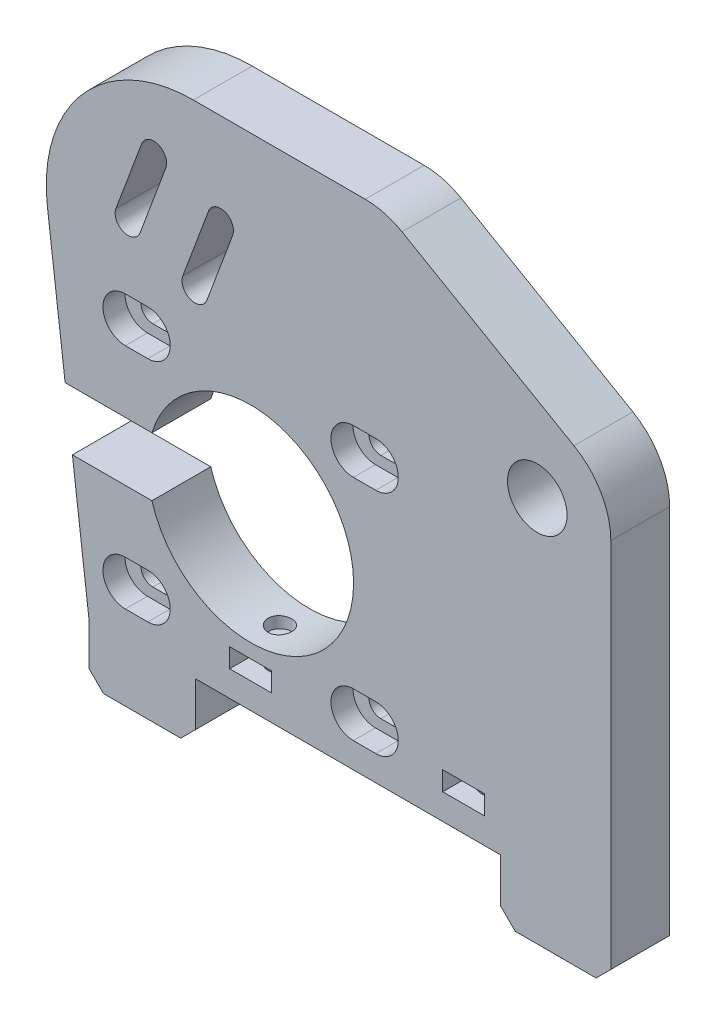
from build123d import *

# Parameters (mm, degrees)
SKETCH_3_R          = 4.05
SKETCH_3_W          = 6.1
SKETCH_3_H          = 3
EXTRUDE_1_DEPTH     = 8
CUT_EXTRUDE_2_DEPTH = 3
SKETCH_6_R          = 1.6
CUT_EXTRUDE_3_DEPTH = 15
SKETCH_7_R          = 4.05
CUT_EXTRUDE_4_DEPTH = 68.662198854
CHAMFER_1_SIZE      = 2
EXTRUDE_2_DEPTH     = 8


with BuildPart() as part:
    # 草图3 → 凸台-拉伸1 (new body)
    with BuildSketch(Plane.XY):
        with BuildLine():
            Line((43.971143614, 31.160253781), (20.588455044, 44.660256921))
            ThreePointArc((20.588455044, 44.660256921), (18.176645298, 45.659261336), (15.5884546, 46.000003139))
            Line((15.5884546, 46.000003139), (-7.779942733, 46.000003139))
            ThreePointArc((-7.779942733, 46.000003139), (-22.764282879, 39.246495142), (-27.628936924, 23.546958177))
            Line((-27.628936924, 23.546958177), (-25.213219189, 4))
            Line((-25.213219189, 4), (-13.416407865, 4))
            ThreePointArc((-13.416407865, 4), (14, 0), (-13.416407865, -4))
            Line((-13.416407865, -4), (-24.224536362, -4))
            Line((-24.224536362, -4), (-22, -22))
            Line((-22, -22), (-22, -30))
            Line((-22, -30), (-7.5, -30))
            Line((-7.5, -30), (-7.5, -22))
            Line((-7.5, -22), (33.97114317, -22))
            Line((33.97114317, -22), (33.97114317, -30))
            Line((33.97114317, -30), (48.97114317, -30))
            Line((48.97114317, -30), (48.97114317, 22.5))
            ThreePointArc((48.97114317, 22.5), (47.631397336, 27.499999778), (43.971143614, 31.160253781))
        make_face()
        with Locations((38.97114317, 22.5)):
            Circle(SKETCH_3_R, mode=Mode.SUBTRACT)
        with Locations((0, -17)):
            Rectangle(SKETCH_3_W, SKETCH_3_H, mode=Mode.SUBTRACT)
        with BuildLine():
            Line((-16.3, 17.1), (-14.7, 17.1))
            ThreePointArc((-14.7, 17.1), (-13.1, 15.5), (-14.7, 13.9))
            Line((-14.7, 13.9), (-16.3, 13.9))
            ThreePointArc((-16.3, 13.9), (-17.9, 15.5), (-16.3, 17.1))
        make_face(mode=Mode.SUBTRACT)
        with BuildLine():
            Line((14.7, 17.1), (16.3, 17.1))
            ThreePointArc((16.3, 17.1), (17.9, 15.5), (16.3, 13.9))
            Line((16.3, 13.9), (14.7, 13.9))
            ThreePointArc((14.7, 13.9), (13.1, 15.5), (14.7, 17.1))
        make_face(mode=Mode.SUBTRACT)
        with BuildLine():
            Line((14.7, -13.9), (16.3, -13.9))
            ThreePointArc((16.3, -13.9), (17.9, -15.5), (16.3, -17.1))
            Line((16.3, -17.1), (14.7, -17.1))
            ThreePointArc((14.7, -17.1), (13.1, -15.5), (14.7, -13.9))
        make_face(mode=Mode.SUBTRACT)
        with BuildLine():
            Line((-16.3, -13.9), (-14.7, -13.9))
            ThreePointArc((-14.7, -13.9), (-13.1, -15.5), (-14.7, -17.1))
            Line((-14.7, -17.1), (-16.3, -17.1))
            ThreePointArc((-16.3, -17.1), (-17.9, -15.5), (-16.3, -13.9))
        make_face(mode=Mode.SUBTRACT)
        with Locations((28.97114317, -17)):
            Rectangle(SKETCH_3_W, SKETCH_3_H, mode=Mode.SUBTRACT)
    extrude(amount=EXTRUDE_1_DEPTH)

    # 草图5 → 切除-拉伸2 (cut)
    with BuildSketch(Plane.XY.offset(8)):
        with BuildLine():
            Line((-17.025, 18.55), (-13.975, 18.55))
            ThreePointArc((-13.975, 18.55), (-10.925, 15.5), (-13.975, 12.45))
            Line((-13.975, 12.45), (-17.025, 12.45))
            ThreePointArc((-17.025, 12.45), (-20.075, 15.5), (-17.025, 18.55))
        make_face()
        with BuildLine():
            Line((13.975, 18.55), (17.025, 18.55))
            ThreePointArc((17.025, 18.55), (20.075, 15.5), (17.025, 12.45))
            Line((17.025, 12.45), (13.975, 12.45))
            ThreePointArc((13.975, 12.45), (10.925, 15.5), (13.975, 18.55))
        make_face()
        with BuildLine():
            Line((13.975, -12.45), (17.025, -12.45))
            ThreePointArc((17.025, -12.45), (20.075, -15.5), (17.025, -18.55))
            Line((17.025, -18.55), (13.975, -18.55))
            ThreePointArc((13.975, -18.55), (10.925, -15.5), (13.975, -12.45))
        make_face()
        with BuildLine():
            Line((-17.025, -12.45), (-13.975, -12.45))
            ThreePointArc((-13.975, -12.45), (-10.925, -15.5), (-13.975, -18.55))
            Line((-13.975, -18.55), (-17.025, -18.55))
            ThreePointArc((-17.025, -18.55), (-20.075, -15.5), (-17.025, -12.45))
        make_face()
    extrude(amount=-CUT_EXTRUDE_2_DEPTH, mode=Mode.SUBTRACT)

    # 草图6 → 切除-拉伸3 (cut)
    with BuildSketch(Plane.XZ.offset(22)):
        with Locations(Location((0, 4, 0), (0, 0, 270))):
            Circle(SKETCH_6_R)
        with Locations(Location((28.97114317, 4, 0), (0, 0, 270))):
            Circle(SKETCH_6_R)
    extrude(amount=-CUT_EXTRUDE_3_DEPTH, mode=Mode.SUBTRACT)

    # 草图7 → 切除-拉伸4 (cut, through all)
    with BuildSketch(Plane.XY.offset(8)):
        with Locations((38.97114317, 22.5)):
            Circle(SKETCH_7_R)
        with BuildLine():
            Line((-9.216024373, 24.574816528), (-5.72042198, 33.943955438))
            ThreePointArc((-5.72042198, 33.943955438), (-3.469092252, 34.971824328), (-2.441223361, 32.7204946))
            Line((-2.441223361, 32.7204946), (-5.936825754, 23.35135569))
            ThreePointArc((-5.936825754, 23.35135569), (-8.188156015, 22.323485372), (-9.216024373, 24.574816528))
        make_face()
        with BuildLine():
            Line((-18.304089115, 27.965550849), (-14.808486722, 37.334689759))
            ThreePointArc((-14.808486722, 37.334689759), (-12.557156994, 38.362558649), (-11.529288104, 36.111228921))
            Line((-11.529288104, 36.111228921), (-15.024890497, 26.742090011))
            ThreePointArc((-15.024890497, 26.742090011), (-17.276220757, 25.714219693), (-18.304089115, 27.965550849))
        make_face()
    extrude(amount=-CUT_EXTRUDE_4_DEPTH, mode=Mode.SUBTRACT)

    # 倒角1
    chamfer_1_edges = [part.edges().sort_by_distance(p)[0] for p in [
        (48.97114317, -30, 4),
        (33.97114317, -30, 4),
        (-7.5, -30, 4),
        (-22, -30, 4),
    ]]
    chamfer(chamfer_1_edges, length=CHAMFER_1_SIZE)

    # 草图8 → 凸台-拉伸2 (add)
    with BuildSketch(Plane.XY.offset(8)):
        Polygon((25.92114317, -15.5), (25.92114317, -18.5), (26.12114317, -18.5), (26.12114317, -15.9), (31.82114317, -15.9), (31.82114317, -18.5), (32.02114317, -18.5), (32.02114317, -15.5), align=None)
        Polygon((-2.85, -18.5), (-2.85, -15.9), (2.85, -15.9), (2.85, -18.5), (3.05, -18.5), (3.05, -15.5), (-3.05, -15.5), (-3.05, -18.5), align=None)
    extrude(amount=-EXTRUDE_2_DEPTH)


solid = part.part
